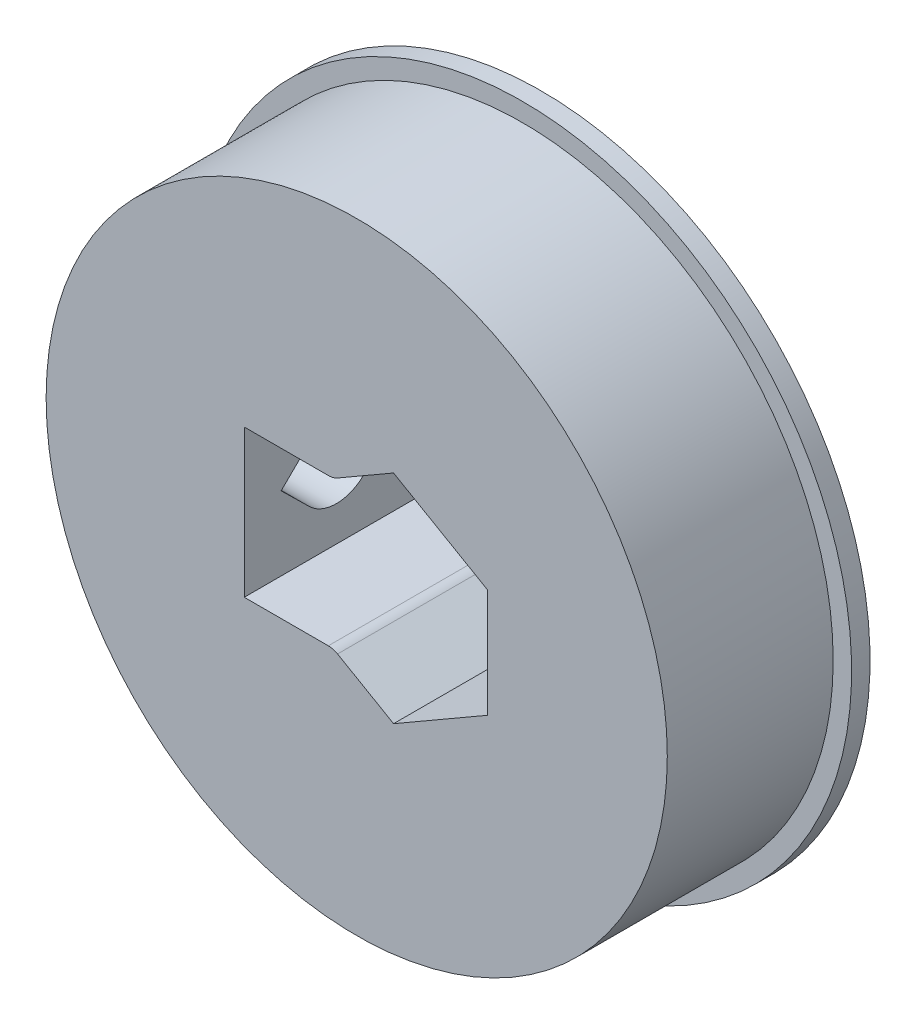
from build123d import *

# Parameters (mm, degrees)
SKETCH1_R                   = 8.425
BOSS_EXTRUDE1_DEPTH         = 5
M2_HEXNUT_CUTOUT_DEPTH      = 1.5
M2_HEXNUT_CUTOUT_DEPTH_BACK = 1.5
SKETCH2_W                   = 5
SKETCH2_H                   = 4
FILLET1_R                   = 0.5
M2_THRU_DEPTH               = 16.088281877
SKETCH4_R                   = 8.925
SKETCH4_R_2                 = 8.425
BOSS_EXTRUDE2_DEPTH         = 0.5


with BuildPart() as part:
    # Sketch1 → Boss-Extrude1 (new body)
    with BuildSketch(Plane.XY):
        with Locations((-1, 0)):
            Circle(SKETCH1_R)
        Polygon((0, -2.944486373), (2.55, -1.472243186), (2.55, 1.472243186), (0, 2.944486373), (-2.55, 1.472243186), (-2.55, -1.472243186), align=None, mode=Mode.SUBTRACT)
    extrude(amount=BOSS_EXTRUDE1_DEPTH)

    # Sketch2 → M2 Hexnut Cutout (cut, two sides: drawn at the far end of the back side and taken through both)
    with BuildSketch(Plane(origin=(-2.55, 0, 0), x_dir=(0, 0, -1), z_dir=(1, 0, 0)).offset(-M2_HEXNUT_CUTOUT_DEPTH_BACK)):
        with Locations((-2.5, 0)):
            Rectangle(SKETCH2_W, SKETCH2_H)
    extrude(amount=M2_HEXNUT_CUTOUT_DEPTH + M2_HEXNUT_CUTOUT_DEPTH_BACK, mode=Mode.SUBTRACT)

    # Fillet1
    fillet1_edges = [part.edges().sort_by_distance(p)[0] for p in [
        (-1.635898385, 2, 2.5),
        (-1.635898385, -2, 2.5),
    ]]
    fillet(fillet1_edges, radius=FILLET1_R)

    # Sketch3 → M2 Thru (cut, through all)
    with BuildSketch(Plane(origin=(-4.05, 0, 0), x_dir=(0, 0, -1), z_dir=(1, 0, 0))):
        with BuildLine():
            Line((-4, 0), (-3.235, -0.749849985))
            ThreePointArc((-3.235, -0.749849985), (-2.5, -1.05), (-1.765, -0.749849985))
            Line((-1.765, -0.749849985), (-1, 0))
            Line((-1, 0), (-1.765, 0.749849985))
            ThreePointArc((-1.765, 0.749849985), (-2.5, 1.05), (-3.235, 0.749849985))
            Line((-3.235, 0.749849985), (-4, 0))
        make_face()
    extrude(amount=-M2_THRU_DEPTH, mode=Mode.SUBTRACT)

    # Sketch4 → Boss-Extrude2 (add)
    with BuildSketch(Plane(origin=(0, 0, 0), x_dir=(-1, 0, 0), z_dir=(0, 0, -1))):
        with Locations((1, 0)):
            Circle(SKETCH4_R)
        with Locations((1, 0)):
            Circle(SKETCH4_R_2, mode=Mode.SUBTRACT)
    extrude(amount=-BOSS_EXTRUDE2_DEPTH)


solid = part.part
